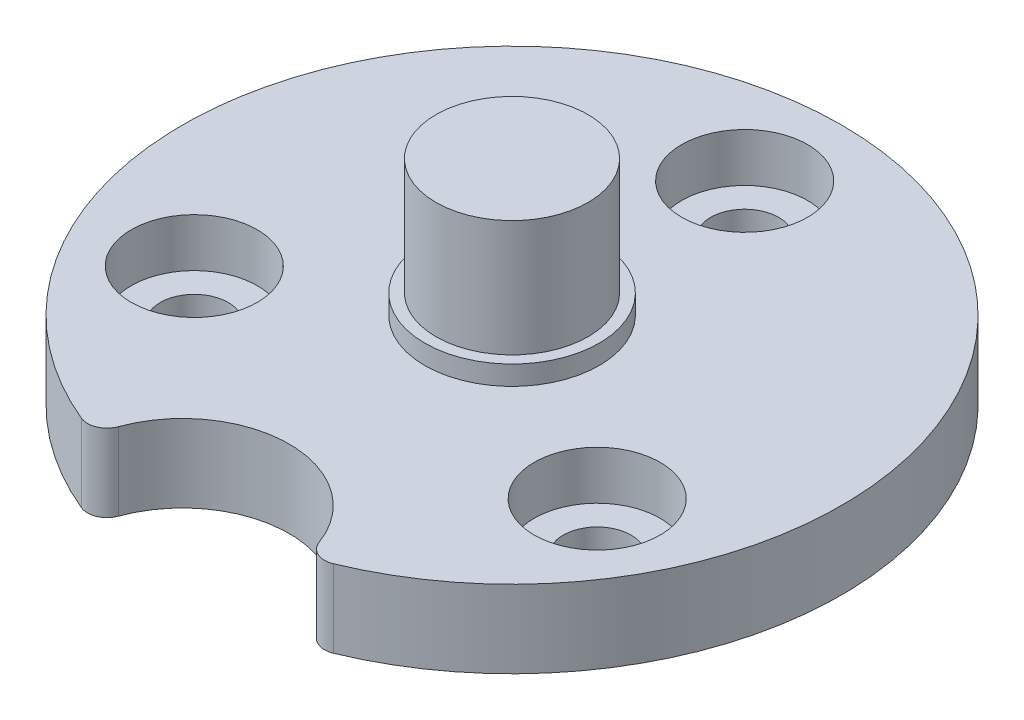
from build123d import *

# Parameters (mm, degrees)
SKETCH1_R           = 17
SKETCH1_R_2         = 1.75
BOSS_EXTRUDE1_DEPTH = 4
SKETCH2_R           = 3.25
CUT_EXTRUDE1_DEPTH  = 2.5
SKETCH3_R           = 4.5
BOSS_EXTRUDE2_DEPTH = 1
SKETCH4_R           = 3.925
BOSS_EXTRUDE3_DEPTH = 6
CUT_EXTRUDE2_REACH  = 27.04
SKETCH5_R           = 5.5
FILLET1_R           = 1


with BuildPart() as part:
    # Sketch1 → Boss-Extrude1 (new body)
    with BuildSketch(Plane(origin=(0, 0, 0), x_dir=(1, 0, 0), z_dir=(0, 1, 0))):
        with Locations(Location((0, 0, 0), (0, 0, 270))):
            Circle(SKETCH1_R)
        with Locations(Location((0, 12, 0), (0, 0, 270))):
            Circle(SKETCH1_R_2, mode=Mode.SUBTRACT)
        with Locations(Location((10.392304845, -6, 0), (0, 0, 270))):
            Circle(SKETCH1_R_2, mode=Mode.SUBTRACT)
        with Locations(Location((-10.392304845, -6, 0), (0, 0, 270))):
            Circle(SKETCH1_R_2, mode=Mode.SUBTRACT)
    extrude(amount=BOSS_EXTRUDE1_DEPTH)

    # Sketch2 → Cut-Extrude1 (cut)
    with BuildSketch(Plane(origin=(0, 4, 0), x_dir=(1, 0, 0), z_dir=(0, 1, 0))):
        with Locations(Location((0, 12, 0), (0, 0, 270))):
            Circle(SKETCH2_R)
        with Locations(Location((10.392304845, -6, 0), (0, 0, 270))):
            Circle(SKETCH2_R)
        with Locations(Location((-10.392304845, -6, 0), (0, 0, 270))):
            Circle(SKETCH2_R)
    extrude(amount=-CUT_EXTRUDE1_DEPTH, mode=Mode.SUBTRACT)

    # Sketch3 → Boss-Extrude2 (add)
    with BuildSketch(Plane(origin=(0, 4, 0), x_dir=(1, 0, 0), z_dir=(0, 1, 0))):
        with Locations(Location((0, 0, 0), (0, 0, 270))):
            Circle(SKETCH3_R)
    extrude(amount=BOSS_EXTRUDE2_DEPTH)

    # Sketch4 → Boss-Extrude3 (add)
    with BuildSketch(Plane(origin=(0, 5, 0), x_dir=(1, 0, 0), z_dir=(0, 1, 0))):
        with Locations(Location((0, 0, 0), (0, 0, 270))):
            Circle(SKETCH4_R)
    extrude(amount=BOSS_EXTRUDE3_DEPTH)

    # Sketch5 → Cut-Extrude2 (cut, up to next)
    with BuildSketch(Plane(origin=(0, 4, 0), x_dir=(1, 0, 0), z_dir=(0, 1, 0)), mode=Mode.PRIVATE) as cut_extrude2_sk1:
        with Locations((0, -17)):
            Circle(SKETCH5_R)
    cut_extrude2_tool1 = extrude(cut_extrude2_sk1.sketch, amount=-CUT_EXTRUDE2_REACH, mode=Mode.PRIVATE) & part.part
    add(cut_extrude2_tool1.solids().sort_by_distance((0, 4, 17))[0], mode=Mode.SUBTRACT)

    # Fillet1
    fillet1_edges = [part.edges().sort_by_distance(p)[0] for p in [
        (-5.427561464, 2, 16.110294118),
        (5.427561464, 2, 16.110294118),
    ]]
    fillet(fillet1_edges, radius=FILLET1_R)


solid = part.part
